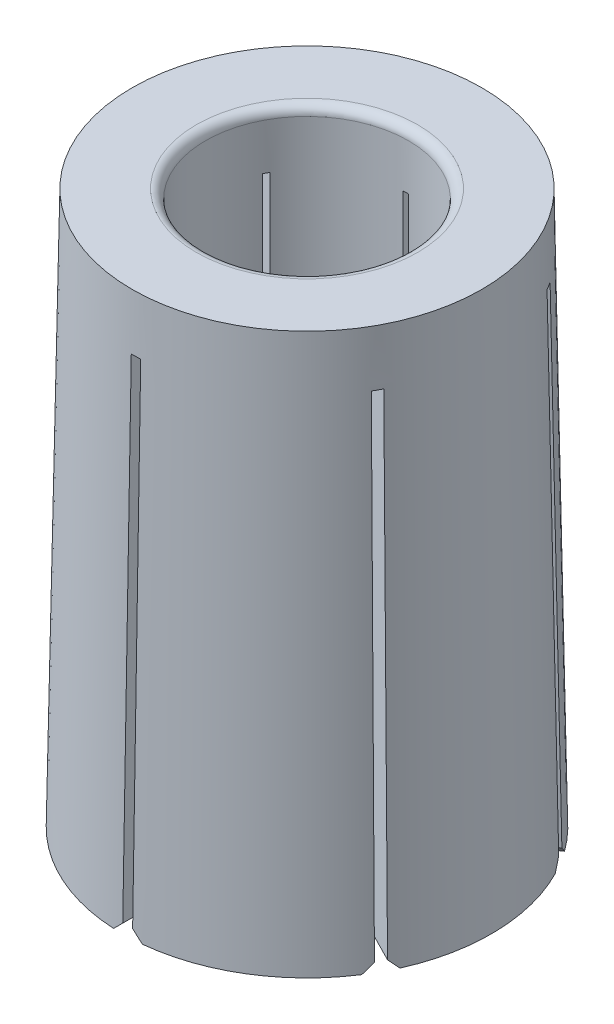
from build123d import *

# Parameters (mm, degrees)
SKETCH2_R           = 10
SKETCH2_R_2         = 3.5
BOSS_EXTRUDE1_DEPTH = 30
BOSS_EXTRUDE1_DRAFT = 1
SKETCH3_R           = 5.5
CUT_EXTRUDE1_DEPTH  = 22
CHAMFER1_SIZE       = 1
CHAMFER1_SIZE2      = 0.982994102
FILLET1_R           = 0.5
CUT_EXTRUDE2_DEPTH  = 27
CHAMFER2_SIZE       = 0.5
FILLET2_R           = 0.5


with BuildPart() as part:
    # Sketch2 → Boss-Extrude1 (with draft: the straight prism first)
    with BuildSketch(Plane(origin=(0, 0, 0), x_dir=(1, 0, 0), z_dir=(0, 1, 0))):
        Circle(SKETCH2_R)
        Circle(SKETCH2_R_2, mode=Mode.SUBTRACT)
    extrude(amount=BOSS_EXTRUDE1_DEPTH)
    # Boss-Extrude1: the draft: its side faces are tilted about the plane it starts from
    boss_extrude1_sides = [part.faces().sort_by_distance(p)[0] for p in [
        (-10, 15, 0),
        (-3.5, 15, 0),
    ]]
    draft(boss_extrude1_sides, Plane(origin=(0, 0, 0), x_dir=(1, 0, 0), z_dir=(0, 1, 0)), BOSS_EXTRUDE1_DRAFT)

    # Sketch3 → Cut-Extrude1 (cut)
    with BuildSketch(Plane(origin=(0, 30, 0), x_dir=(1, 0, 0), z_dir=(0, 1, 0))):
        with Locations(Location((0, 0, 0), (0, 0, 270))):
            Circle(SKETCH3_R)
    extrude(amount=-CUT_EXTRUDE1_DEPTH, mode=Mode.SUBTRACT)

    # Chamfer1
    chamfer1_edges = [part.edges().sort_by_distance(p)[0] for p in [
        (-3.5, 0, 0),
    ]]
    chamfer1_side = [part.faces().sort_by_distance(p)[0] for p in [
        (-3.56982026, 4, 0),
    ]]
    chamfer(chamfer1_edges, length=CHAMFER1_SIZE, length2=CHAMFER1_SIZE2, reference=chamfer1_side[0])

    # Fillet1
    fillet1_edges = [part.edges().sort_by_distance(p)[0] for p in [
        (-3.639640519, 8, 0),
    ]]
    fillet(fillet1_edges, radius=FILLET1_R)

    # Sketch4 → Cut-Extrude2 (cut)
    with BuildSketch(Plane.XZ):
        with BuildLine():
            Line((0, 3.5), (0, 10))
            ThreePointArc((0, 10), (0.261769483, 9.99657325), (0.523359562, 9.986295348))
            Line((0.523359562, 9.986295348), (0.183175847, 3.495203372))
            ThreePointArc((0.183175847, 3.495203372), (0.091619319, 3.498800637), (0, 3.5))
        make_face()
        with BuildLine():
            Line((3.031088913, 1.75), (8.660254038, 5))
            ThreePointArc((8.660254038, 5), (8.788171127, 4.771587603), (8.910065242, 4.539904997))
            Line((8.910065242, 4.539904997), (3.118522835, 1.588966749))
            ThreePointArc((3.118522835, 1.588966749), (3.075859894, 1.670055661), (3.031088913, 1.75))
        make_face()
        with BuildLine():
            Line((3.031088913, -1.75), (8.660254038, -5))
            ThreePointArc((8.660254038, -5), (8.526401644, -5.224985647), (8.386705679, -5.44639035))
            Line((8.386705679, -5.44639035), (2.935346988, -1.906236623))
            ThreePointArc((2.935346988, -1.906236623), (2.984240575, -1.828744977), (3.031088913, -1.75))
        make_face()
        with BuildLine():
            Line((0, -3.5), (0, -10))
            ThreePointArc((0, -10), (-0.261769483, -9.99657325), (-0.523359562, -9.986295348))
            Line((-0.523359562, -9.986295348), (-0.183175847, -3.495203372))
            ThreePointArc((-0.183175847, -3.495203372), (-0.091619319, -3.498800637), (0, -3.5))
        make_face()
        with BuildLine():
            Line((-3.031088913, -1.75), (-8.660254038, -5))
            ThreePointArc((-8.660254038, -5), (-8.788171127, -4.771587603), (-8.910065242, -4.539904997))
            Line((-8.910065242, -4.539904997), (-3.118522835, -1.588966749))
            ThreePointArc((-3.118522835, -1.588966749), (-3.075859894, -1.670055661), (-3.031088913, -1.75))
        make_face()
        with BuildLine():
            Line((-3.031088913, 1.75), (-8.660254038, 5))
            ThreePointArc((-8.660254038, 5), (-8.526401644, 5.224985647), (-8.386705679, 5.44639035))
            Line((-8.386705679, 5.44639035), (-2.935346988, 1.906236623))
            ThreePointArc((-2.935346988, 1.906236623), (-2.984240575, 1.828744977), (-3.031088913, 1.75))
        make_face()
    extrude(amount=-CUT_EXTRUDE2_DEPTH, mode=Mode.SUBTRACT)

    # Chamfer2
    chamfer2_edges = [part.edges().sort_by_distance(p)[0] for p in [
        (-0.378990673, 0, -7.231572831),
        (0, 0, -7.241497051),
        (-6.452221117, 0, -3.287570865),
        (-6.271320408, 0, -3.620748526),
        (-6.073230445, 0, 3.944001966),
        (-6.271320408, 0, 3.620748526),
        (0.378990673, 0, 7.231572831),
        (0, 0, 7.241497051),
        (6.452221117, 0, 3.287570865),
        (6.271320408, 0, 3.620748526),
        (6.073230445, 0, -3.944001966),
        (6.271320408, 0, -3.620748526),
    ]]
    chamfer(chamfer2_edges, length=CHAMFER2_SIZE)

    # Fillet2
    fillet2_edges = [part.edges().sort_by_distance(p)[0] for p in [
        (0, 30, -5.5),
    ]]
    fillet(fillet2_edges, radius=FILLET2_R)


solid = part.part
